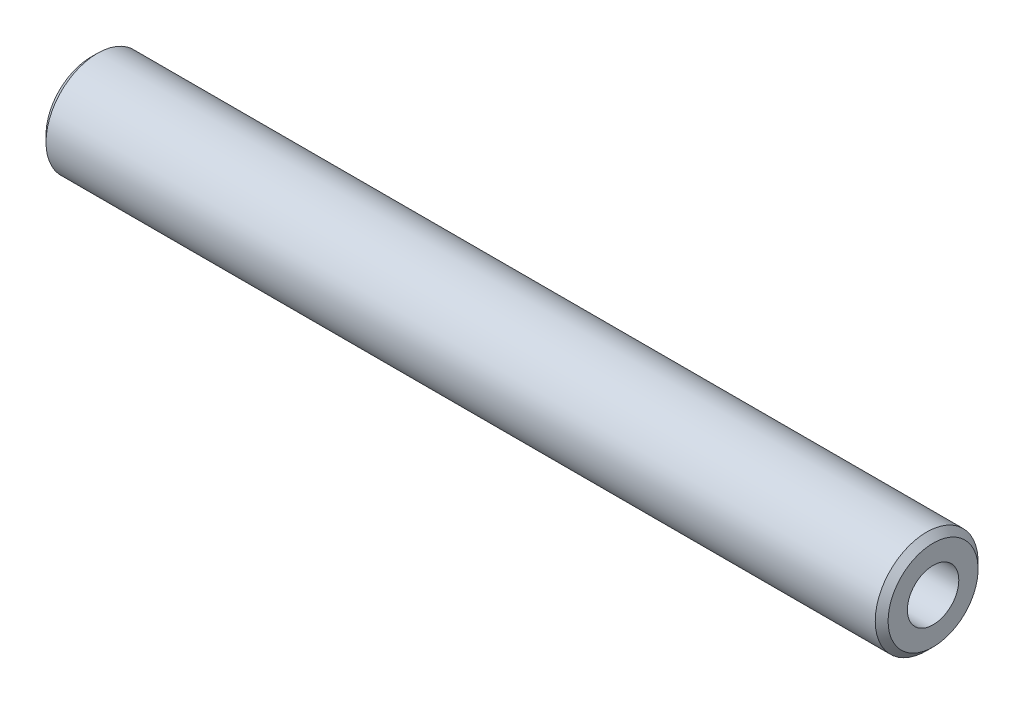
from build123d import *

# Parameters (mm, degrees)
SKETCH_1_W                     = 65.5
SKETCH_1_H                     = 4
M4X0_7_1_D                     = 3.3
M4X0_7_1_DEPTH                 = 11.5
M4X0_7_1_CBORE_D               = 4
M4X0_7_1_CBORE_DEPTH           = 8
M4X0_7_1_TIP                   = 0.991420021
M4X0_7_1_ON_FACE_2_D           = 3.3
M4X0_7_1_ON_FACE_2_DEPTH       = 11.5
M4X0_7_1_ON_FACE_2_CBORE_D     = 4
M4X0_7_1_ON_FACE_2_CBORE_DEPTH = 8
M4X0_7_1_ON_FACE_2_TIP         = 0.991420021
CHAMFER_1_SIZE                 = 0.5


with BuildPart() as part:
    # ｽｹｯﾁ1 → 回転1 (revolve)
    with BuildSketch(Plane.XY, mode=Mode.PRIVATE) as revolve_1_sk:
        with Locations((0, 2)):
            Rectangle(SKETCH_1_W, SKETCH_1_H)
    revolve(revolve_1_sk.sketch.rotate(Axis((0, 0, 0), (1, 0, 0)), 90), axis=Axis((0, 0, 0), (1, 0, 0)))

    # M4x0.7 ねじ穴1
    with Locations(Plane(origin=(32.75, 0, 0), x_dir=(0, 0, 1), z_dir=(1, 0, 0))):
        with Locations((0, 0)):
            CounterBoreHole(M4X0_7_1_D / 2, M4X0_7_1_CBORE_D / 2, M4X0_7_1_CBORE_DEPTH, depth=M4X0_7_1_DEPTH)
            with Locations((0, 0, -(M4X0_7_1_DEPTH + M4X0_7_1_TIP / 2))):  # 118° drill point
                Cone(0, M4X0_7_1_D / 2, M4X0_7_1_TIP, mode=Mode.SUBTRACT)

    # M4x0.7 ねじ穴1 on face 2
    with Locations(Plane(origin=(-32.75, 0, 0), x_dir=(0, 0, -1), z_dir=(-1, 0, 0))):
        with Locations((0, 0)):
            CounterBoreHole(M4X0_7_1_ON_FACE_2_D / 2, M4X0_7_1_ON_FACE_2_CBORE_D / 2, M4X0_7_1_ON_FACE_2_CBORE_DEPTH, depth=M4X0_7_1_ON_FACE_2_DEPTH)
            with Locations((0, 0, -(M4X0_7_1_ON_FACE_2_DEPTH + M4X0_7_1_ON_FACE_2_TIP / 2))):  # 118° drill point
                Cone(0, M4X0_7_1_ON_FACE_2_D / 2, M4X0_7_1_ON_FACE_2_TIP, mode=Mode.SUBTRACT)

    # 面取り1
    chamfer_1_edges = [part.edges().sort_by_distance(p)[0] for p in [
        (32.75, 0, -4),
        (-32.75, 0, -4),
    ]]
    chamfer(chamfer_1_edges, length=CHAMFER_1_SIZE)


solid = part.part
